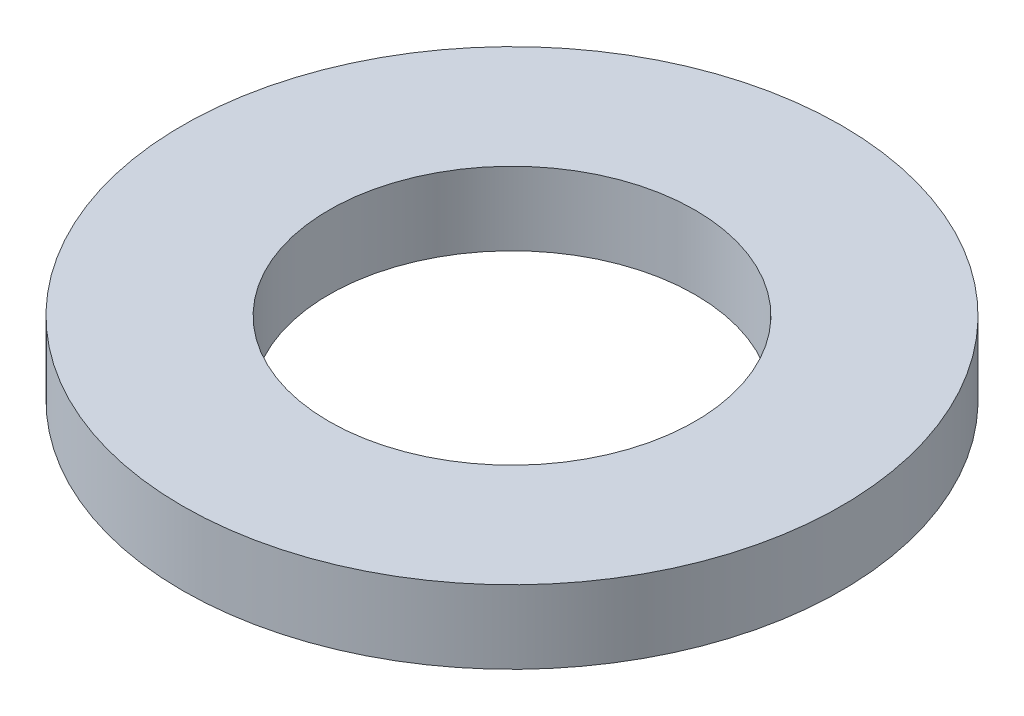
from build123d import *

# Parameters (mm, degrees)
SKETCH1_R           = 4.5
SKETCH1_R_2         = 2.5
BOSS_EXTRUDE1_DEPTH = 1


with BuildPart() as part:
    # Sketch1 → Boss-Extrude1 (new body)
    with BuildSketch(Plane(origin=(0, 0, 0), x_dir=(1, 0, 0), z_dir=(0, 1, 0))):
        with Locations(Location((0, 0, 0), (0, 0, 270))):
            Circle(SKETCH1_R)
        with Locations(Location((0, 0, 0), (0, 0, 270))):
            Circle(SKETCH1_R_2, mode=Mode.SUBTRACT)
    extrude(amount=BOSS_EXTRUDE1_DEPTH)


solid = part.part
